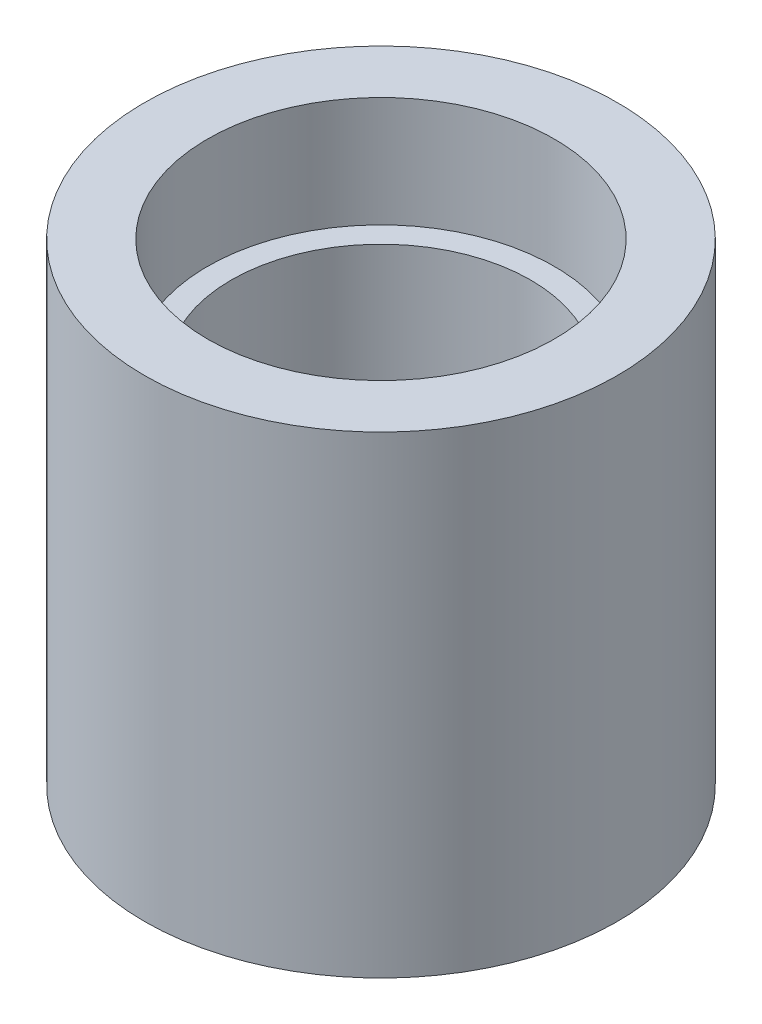
from build123d import *

# Parameters (mm, degrees)
CROQUIS2_R              = 15
SALIENTE_EXTRUIR2_DEPTH = 30
CROQUIS3_R              = 11
CORTAR_EXTRUIR1_DEPTH   = 7
CORTAR_EXTRUIR2_START   = -7
CROQUIS4_R              = 11
CORTAR_EXTRUIR2_DEPTH   = 7
CORTAR_EXTRUIR3_REACH   = 33.289
CROQUIS5_R              = 9.5


with BuildPart() as part:
    # Croquis2 → Saliente-Extruir2 (new body)
    with BuildSketch(Plane(origin=(0, 0, 0), x_dir=(1, 0, 0), z_dir=(0, 1, 0))):
        with Locations(Location((0, 0, 0), (0, 0, 270))):
            Circle(CROQUIS2_R)
    extrude(amount=SALIENTE_EXTRUIR2_DEPTH)

    # Croquis3 → Cortar-Extruir1 (cut)
    with BuildSketch(Plane(origin=(0, 30, 0), x_dir=(1, 0, 0), z_dir=(0, 1, 0))):
        with Locations(Location((0, 0, 0), (0, 0, 270))):
            Circle(CROQUIS3_R)
    extrude(amount=-CORTAR_EXTRUIR1_DEPTH, mode=Mode.SUBTRACT)

    # Croquis4 → Cortar-Extruir2 (cut)
    with BuildSketch(Plane(origin=(0, 0, 0), x_dir=(-1, 0, 0), z_dir=(0, -1, 0)).offset(CORTAR_EXTRUIR2_START)):
        with Locations(Location((0, 0, 0), (0, 0, 270))):
            Circle(CROQUIS4_R)
    extrude(amount=CORTAR_EXTRUIR2_DEPTH, mode=Mode.SUBTRACT)

    # Croquis5 → Cortar-Extruir3 (cut, up to next)
    with BuildSketch(Plane(origin=(0, 23, 0), x_dir=(1, 0, 0), z_dir=(0, 1, 0)), mode=Mode.PRIVATE) as cortar_extruir3_sk1:
        with Locations(Location((0, 0, 0), (0, 0, 270))):
            Circle(CROQUIS5_R)
    cortar_extruir3_tool1 = extrude(cortar_extruir3_sk1.sketch, amount=-CORTAR_EXTRUIR3_REACH, mode=Mode.PRIVATE) & part.part
    add(cortar_extruir3_tool1.solids().sort_by_distance((0, 23, 0))[0], mode=Mode.SUBTRACT)


solid = part.part
